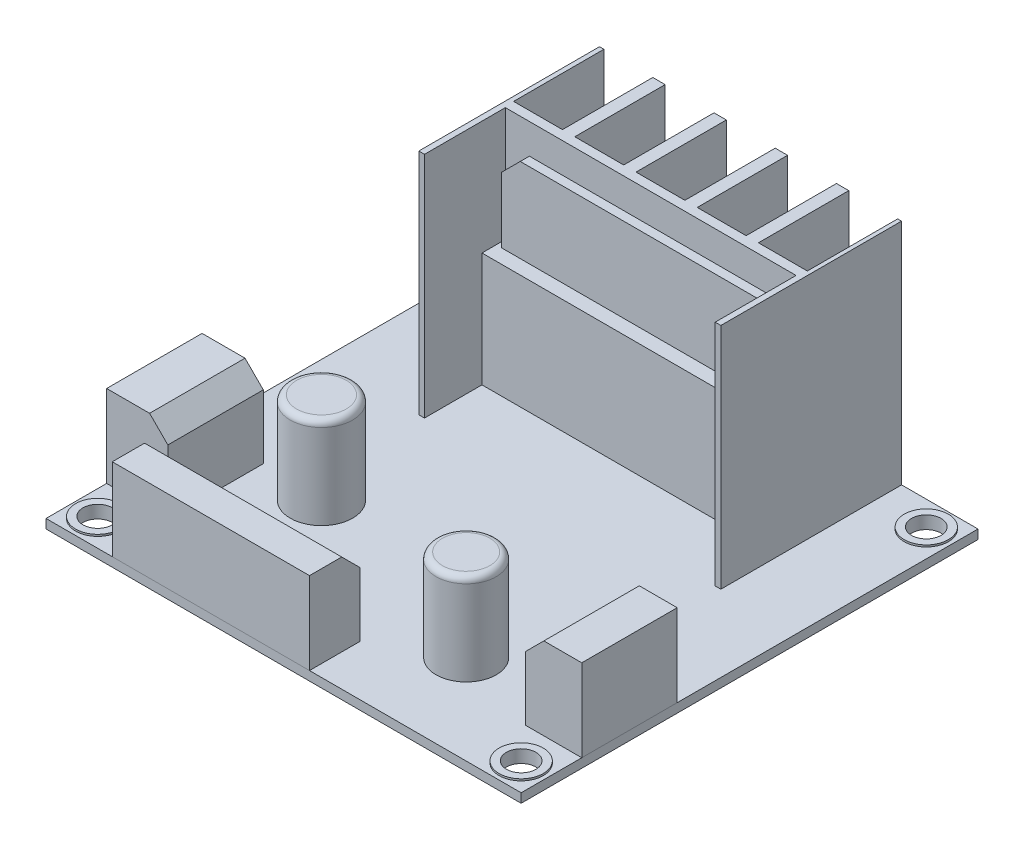
from build123d import *

# Parameters (mm, degrees)
SKETCH1_W                = 52
SKETCH1_H                = 50
BOSS_EXTRUDE1_DEPTH      = 1
SKETCH2_W                = 21.580611169
SKETCH2_H                = 5.529031909
BOSS_EXTRUDE2_DEPTH      = 9
SKETCH2_W_2              = 6.701953473
SKETCH2_H_2              = 10.444462457
BOSS_EXTRUDE2_2_DEPTH    = 9
SKETCH2_W_3              = 6.148604469
BOSS_EXTRUDE2_3_DEPTH    = 9
SKETCH3_R                = 3.417378128
BOSS_EXTRUDE3_DEPTH      = 10
SKETCH3_R_2              = 3.294779793
BOSS_EXTRUDE3_2_DEPTH    = 10
SKETCH4_R                = 1.614757822
CUT_EXTRUDE1_DEPTH       = 10
BOSS_EXTRUDE4_DEPTH      = 0.2
BOSS_EXTRUDE4_DEPTH_BACK = 1.2
SKETCH5_R                = 2.415956226
SKETCH5_R_2              = 1.614757822
SKETCH6_W                = 33.06260301
SKETCH6_H                = 19.777768771
BOSS_EXTRUDE5_DEPTH      = 25
SKETCH7_W                = 5.35
SKETCH7_H                = 9.886655319
CUT_EXTRUDE2_DEPTH       = 25
SKETCH8_W                = 31.81756775
SKETCH8_H                = 8.853584069
CUT_EXTRUDE3_DEPTH       = 12.5
SKETCH9_W                = 31.81756775
SKETCH9_H                = 6.294344924
CUT_EXTRUDE4_DEPTH       = 12.5
BOSS_EXTRUDE6_DEPTH      = 1
FILLET1_R                = 0.7
FILLET2_R                = 0.7
CHAMFER1_SIZE            = 2
CHAMFER2_SIZE            = 2
CHAMFER3_SIZE            = 2


with BuildPart() as part:
    # Sketch1 → Boss-Extrude1 (new body)
    with BuildSketch(Plane(origin=(0, 0, 0), x_dir=(1, 0, 0), z_dir=(0, 1, 0))):
        Rectangle(SKETCH1_W, SKETCH1_H)
    extrude(amount=BOSS_EXTRUDE1_DEPTH)

    # Sketch4 → Cut-Extrude1 (cut)
    with BuildSketch(Plane(origin=(0, 1, 0), x_dir=(1, 0, 0), z_dir=(0, 1, 0))):
        with Locations(Location((-23.171489557, 22.168544487, 0), (0, 0, 270))):
            Circle(SKETCH4_R)
        with Locations(Location((23.171489557, 22.168544487, 0), (0, 0, 90))):
            Circle(SKETCH4_R)
        with Locations(Location((23.171489557, -22.168544487, 0), (0, 0, 270))):
            Circle(SKETCH4_R)
        with Locations(Location((-23.171489557, -22.168544487, 0), (0, 0, 90))):
            Circle(SKETCH4_R)
    extrude(amount=-CUT_EXTRUDE1_DEPTH, mode=Mode.SUBTRACT)

    # Sketch5 → Boss-Extrude4 (add, two sides: drawn at the far end of the back side and taken through both)
    # profile 1 of 4: a face of its own
    with BuildSketch(Plane(origin=(0, 1, 0), x_dir=(1, 0, 0), z_dir=(0, 1, 0)).offset(-BOSS_EXTRUDE4_DEPTH_BACK)):
        with Locations(Location((-23.171489557, 22.168544487, 0), (0, 0, 270))):
            Circle(SKETCH5_R)
        with Locations(Location((-23.171489557, 22.168544487, 0), (0, 0, 270))):
            Circle(SKETCH5_R_2, mode=Mode.SUBTRACT)
    # profile 2 of 4: a face of its own
    with BuildSketch(Plane(origin=(0, 1, 0), x_dir=(1, 0, 0), z_dir=(0, 1, 0)).offset(-BOSS_EXTRUDE4_DEPTH_BACK)):
        with Locations(Location((23.171489557, 22.168544487, 0), (0, 0, 90))):
            Circle(SKETCH5_R)
        with Locations(Location((23.171489557, 22.168544487, 0), (0, 0, 90))):
            Circle(SKETCH5_R_2, mode=Mode.SUBTRACT)
    # profile 3 of 4: a face of its own
    with BuildSketch(Plane(origin=(0, 1, 0), x_dir=(1, 0, 0), z_dir=(0, 1, 0)).offset(-BOSS_EXTRUDE4_DEPTH_BACK)):
        with Locations(Location((23.171489557, -22.168544487, 0), (0, 0, 270))):
            Circle(SKETCH5_R)
        with Locations(Location((23.171489557, -22.168544487, 0), (0, 0, 270))):
            Circle(SKETCH5_R_2, mode=Mode.SUBTRACT)
    # profile 4 of 4: a face of its own
    with BuildSketch(Plane(origin=(0, 1, 0), x_dir=(1, 0, 0), z_dir=(0, 1, 0)).offset(-BOSS_EXTRUDE4_DEPTH_BACK)):
        with Locations(Location((-23.171489557, -22.168544487, 0), (0, 0, 90))):
            Circle(SKETCH5_R)
        with Locations(Location((-23.171489557, -22.168544487, 0), (0, 0, 90))):
            Circle(SKETCH5_R_2, mode=Mode.SUBTRACT)
    extrude(amount=BOSS_EXTRUDE4_DEPTH + BOSS_EXTRUDE4_DEPTH_BACK)


with BuildPart() as body_2:
    # Sketch2 → Boss-Extrude2 (new body)
    with BuildSketch(Plane(origin=(0, 1, 0), x_dir=(1, 0, 0), z_dir=(0, 1, 0))):
        with Locations((-7.954391938, -22.235484046)):
            Rectangle(SKETCH2_W, SKETCH2_H)
    extrude(amount=BOSS_EXTRUDE2_DEPTH)

    # Chamfer2
    chamfer2_edges = [body_2.edges().sort_by_distance(p)[0] for p in [
        (-7.954391938, 10, 19.470968091),
    ]]
    chamfer(chamfer2_edges, length=CHAMFER2_SIZE)


with BuildPart() as body_3:
    # Sketch2 → Boss-Extrude2 2 (new body)
    with BuildSketch(Plane(origin=(0, 1, 0), x_dir=(1, 0, 0), z_dir=(0, 1, 0))):
        with Locations((-22.649023263, -13.142038854)):
            Rectangle(SKETCH2_W_2, SKETCH2_H_2)
    extrude(amount=BOSS_EXTRUDE2_2_DEPTH)

    # Chamfer3
    chamfer3_edges = [body_3.edges().sort_by_distance(p)[0] for p in [
        (-19.298046527, 10, 13.142038853),
    ]]
    chamfer(chamfer3_edges, length=CHAMFER3_SIZE)


with BuildPart() as body_4:
    # Sketch2 → Boss-Extrude2 3 (new body)
    with BuildSketch(Plane(origin=(0, 1, 0), x_dir=(1, 0, 0), z_dir=(0, 1, 0))):
        with Locations((22.925697766, -13.142038854)):
            Rectangle(SKETCH2_W_3, SKETCH2_H_2)
    extrude(amount=BOSS_EXTRUDE2_3_DEPTH)

    # Chamfer1
    chamfer1_edges = [body_4.edges().sort_by_distance(p)[0] for p in [
        (19.851395531, 10, 13.142038853),
    ]]
    chamfer(chamfer1_edges, length=CHAMFER1_SIZE)


with BuildPart() as body_5:
    # Sketch3 → Boss-Extrude3 (new body)
    with BuildSketch(Plane(origin=(0, 1, 0), x_dir=(1, 0, 0), z_dir=(0, 1, 0))):
        with Locations(Location((-12.657858475, -8.196482127, 0), (0, 0, 270))):
            Circle(SKETCH3_R)
    extrude(amount=BOSS_EXTRUDE3_DEPTH)

    # Fillet2
    fillet2_edges = [body_5.edges().sort_by_distance(p)[0] for p in [
        (-12.657858475, 11, 4.779103999),
    ]]
    fillet(fillet2_edges, radius=FILLET2_R)


with BuildPart() as body_6:
    # Sketch3 → Boss-Extrude3 2 (new body)
    with BuildSketch(Plane(origin=(0, 1, 0), x_dir=(1, 0, 0), z_dir=(0, 1, 0))):
        with Locations(Location((10.167787955, -15.182513307, 0), (0, 0, 270))):
            Circle(SKETCH3_R_2)
    extrude(amount=BOSS_EXTRUDE3_2_DEPTH)

    # Fillet1
    fillet1_edges = [body_6.edges().sort_by_distance(p)[0] for p in [
        (10.167787955, 11, 11.887733514),
    ]]
    fillet(fillet1_edges, radius=FILLET1_R)


with BuildPart() as body_7:
    # Sketch6 → Boss-Extrude5 (new body)
    with BuildSketch(Plane(origin=(0, 1, 0), x_dir=(1, 0, 0), z_dir=(0, 1, 0))):
        with Locations((1.106698009, 15.111115615)):
            Rectangle(SKETCH6_W, SKETCH6_H)
    extrude(amount=BOSS_EXTRUDE5_DEPTH)

    # Sketch7 → Cut-Extrude2 (cut)
    with BuildSketch(Plane(origin=(0, 26, 0), x_dir=(1, 0, 0), z_dir=(0, 1, 0))):
        with Locations((-12.265423117, 20.056672341)):
            Rectangle(SKETCH7_W, SKETCH7_H)
        with Locations((-5.565423117, 20.056672341)):
            Rectangle(SKETCH7_W, SKETCH7_H)
        with Locations((1.134576883, 20.056672341)):
            Rectangle(SKETCH7_W, SKETCH7_H)
        with Locations((7.834576883, 20.056672341)):
            Rectangle(SKETCH7_W, SKETCH7_H)
        with Locations((14.534576883, 20.056672341)):
            Rectangle(SKETCH7_W, SKETCH7_H)
    extrude(amount=-CUT_EXTRUDE2_DEPTH, mode=Mode.SUBTRACT)

    # Sketch8 → Cut-Extrude3 (cut)
    with BuildSketch(Plane(origin=(0, 26, 0), x_dir=(1, 0, 0), z_dir=(0, 1, 0))):
        with Locations((1.106698009, 9.649023264)):
            Rectangle(SKETCH8_W, SKETCH8_H)
    extrude(amount=-CUT_EXTRUDE3_DEPTH, mode=Mode.SUBTRACT)

    # Sketch9 → Cut-Extrude4 (cut)
    with BuildSketch(Plane(origin=(0, 13.5, 0), x_dir=(1, 0, 0), z_dir=(0, 1, 0))):
        with Locations((1.106698009, 8.369403691)):
            Rectangle(SKETCH9_W, SKETCH9_H)
    extrude(amount=-CUT_EXTRUDE4_DEPTH, mode=Mode.SUBTRACT)

    # Sketch10 → Boss-Extrude6 (add)
    with BuildSketch(Plane.XY.offset(-14.075815298)):
        Polygon((-14.230124214, 13.5), (-14.230124214, 20.654305968), (-12.173426573, 22.711003608), (14.386822591, 22.711003608), (16.443520231, 20.654305968), (16.443520231, 13.5), align=None)
    extrude(amount=BOSS_EXTRUDE6_DEPTH)


solid = Compound([part.part, body_2.part, body_3.part, body_4.part, body_5.part, body_6.part, body_7.part])
